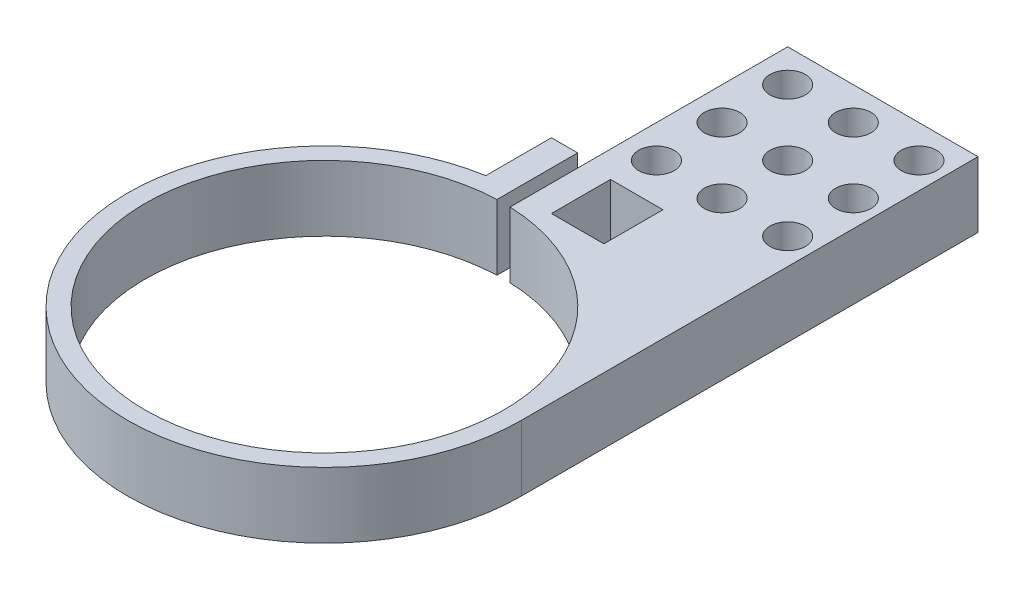
from build123d import *

# Parameters (mm, degrees)
SKETCH1_R           = 38.1
SKETCH1_R_2         = 34.671
BOSS_EXTRUDE1_DEPTH = 12.7
SKETCH2_W           = 12.7
SKETCH2_H           = 12.7
BOSS_EXTRUDE2_DEPTH = 12.7
SKETCH4_W           = 2.54
SKETCH4_H           = 58.988343485
CUT_EXTRUDE2_DEPTH  = 65.340360647
BOSS_EXTRUDE3_REACH = 104.44
BOSS_EXTRUDE3_START = 38.1
SKETCH5_W           = 50.267106623
SKETCH5_H           = 12.7
SKETCH6_W           = 36.83
SKETCH6_H           = 50.8
BOSS_EXTRUDE4_DEPTH = 12.7
SKETCH7_R           = 3.429
SKETCH7_W           = 10.16
SKETCH7_H           = 11.43
CUT_EXTRUDE3_DEPTH  = 109.754126547
SKETCH8_W           = 36.83
SKETCH8_H           = 12.7
CUT_EXTRUDE4_DEPTH  = 109.754126547


with BuildPart() as part:
    # Sketch1 → Boss-Extrude1 (new body)
    with BuildSketch(Plane(origin=(0, 0, 0), x_dir=(1, 0, 0), z_dir=(0, 1, 0))):
        with Locations(Location((0, 0, 0), (0, 0, 270))):
            Circle(SKETCH1_R)
        with Locations(Location((0, 0, 0), (0, 0, 270))):
            Circle(SKETCH1_R_2, mode=Mode.SUBTRACT)
    extrude(amount=BOSS_EXTRUDE1_DEPTH)

    # Sketch2 → Boss-Extrude2 (add)
    with BuildSketch(Plane(origin=(0, 0, 0), x_dir=(1, 0, 0), z_dir=(0, 1, 0))):
        with Locations((0, 43.917106623)):
            Rectangle(SKETCH2_W, SKETCH2_H)
    extrude(amount=BOSS_EXTRUDE2_DEPTH)

    # Sketch4 → Cut-Extrude2 (cut, through all)
    with BuildSketch(Plane(origin=(0, 0, 0), x_dir=(1, 0, 0), z_dir=(0, 1, 0))):
        with Locations((0, 30.925816426)):
            Rectangle(SKETCH4_W, SKETCH4_H)
    extrude(amount=CUT_EXTRUDE2_DEPTH, mode=Mode.SUBTRACT)

    # Sketch5 → Boss-Extrude3 (add, up to next)
    with BuildSketch(Plane(origin=(0, 0, 0), x_dir=(0, 0, -1), z_dir=(1, 0, 0)).offset(BOSS_EXTRUDE3_START), mode=Mode.PRIVATE) as boss_extrude3_sk1:
        with Locations((25.133553312, 6.35)):
            Rectangle(SKETCH5_W, SKETCH5_H)
    boss_extrude3_tool1 = extrude(boss_extrude3_sk1.sketch, amount=-BOSS_EXTRUDE3_REACH, mode=Mode.PRIVATE) - part.part
    add(boss_extrude3_tool1.solids().sort_by_distance((38.1, 6.35, -25.133553))[0])

    # Sketch6 → Boss-Extrude4 (add)
    with BuildSketch(Plane(origin=(0, 12.7, 0), x_dir=(1, 0, 0), z_dir=(0, 1, 0))):
        with Locations((19.685, 75.667106623)):
            Rectangle(SKETCH6_W, SKETCH6_H)
    extrude(amount=-BOSS_EXTRUDE4_DEPTH)

    # Sketch7 → Cut-Extrude3 (cut, through all)
    with BuildSketch(Plane(origin=(0, 0, 0), x_dir=(1, 0, 0), z_dir=(0, 1, 0))):
        with Locations(Location((7.62, 94.717106623, 0), (0, 0, 270))):
            Circle(SKETCH7_R)
        with Locations(Location((20.32, 94.717106623, 0), (0, 0, 270))):
            Circle(SKETCH7_R)
        with Locations(Location((20.32, 82.017106623, 0), (0, 0, 270))):
            Circle(SKETCH7_R)
        with Locations(Location((7.62, 82.017106623, 0), (0, 0, 270))):
            Circle(SKETCH7_R)
        with Locations(Location((7.62, 69.317106623, 0), (0, 0, 270))):
            Circle(SKETCH7_R)
        with Locations(Location((20.32, 69.317106623, 0), (0, 0, 270))):
            Circle(SKETCH7_R)
        with Locations(Location((7.62, 56.617106623, 0), (0, 0, 270))):
            Circle(SKETCH7_R)
        with Locations(Location((20.32, 56.617106623, 0), (0, 0, 270))):
            Circle(SKETCH7_R)
        with Locations(Location((33.02, 94.717106623, 0), (0, 0, 270))):
            Circle(SKETCH7_R)
        with Locations(Location((33.02, 82.017106623, 0), (0, 0, 270))):
            Circle(SKETCH7_R)
        with Locations(Location((33.02, 69.317106623, 0), (0, 0, 270))):
            Circle(SKETCH7_R)
        with Locations(Location((33.02, 56.617106623, 0), (0, 0, 270))):
            Circle(SKETCH7_R)
        with Locations((11.43, 43.282106623)):
            Rectangle(SKETCH7_W, SKETCH7_H)
    extrude(amount=CUT_EXTRUDE3_DEPTH, mode=Mode.SUBTRACT)

    # Sketch8 → Cut-Extrude4 (cut, through all)
    with BuildSketch(Plane(origin=(0, 12.7, 0), x_dir=(1, 0, 0), z_dir=(0, 1, 0))):
        with Locations((19.685, 94.717106623)):
            Rectangle(SKETCH8_W, SKETCH8_H)
    extrude(amount=-CUT_EXTRUDE4_DEPTH, mode=Mode.SUBTRACT)


solid = part.part
